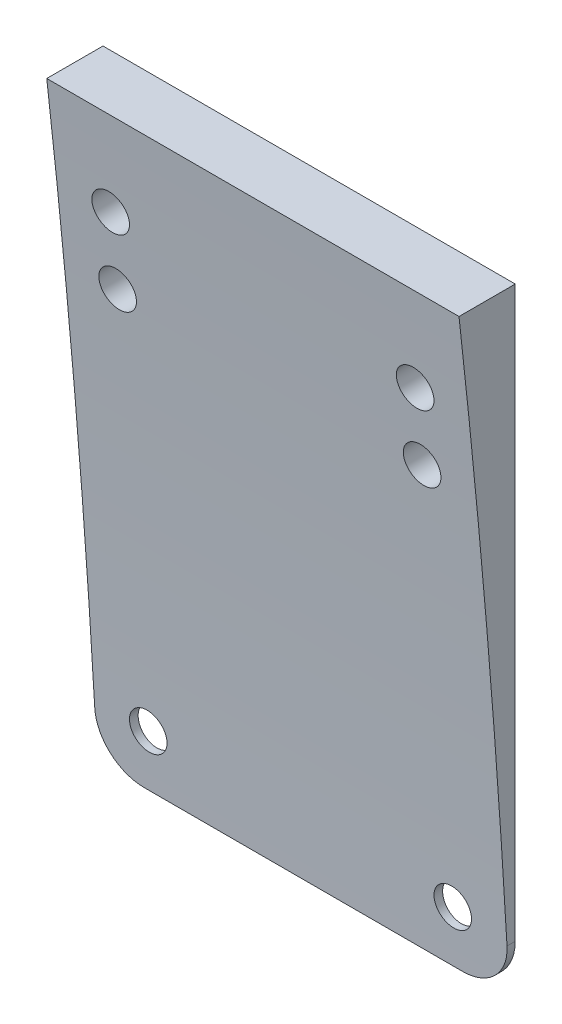
from build123d import *

# Parameters (mm, degrees)
BOSS_EXTRUDE1_DEPTH = 7.62
SKETCH2_R           = 2.54
CUT_EXTRUDE1_DEPTH  = 58.101472453
CUT_EXTRUDE2_DEPTH  = 75.849909527


with BuildPart() as part:
    # Sketch1 → Boss-Extrude1 (new body)
    with BuildSketch(Plane.XY):
        with BuildLine():
            Line((27.94, 49.2125), (-27.94, 49.2125))
            Line((-27.94, 49.2125), (-27.94, -27.94))
            ThreePointArc((-27.94, -27.94), (-26.080128061, -32.430128061), (-21.59, -34.29))
            Line((-21.59, -34.29), (21.59, -34.29))
            ThreePointArc((21.59, -34.29), (26.080128061, -32.430128061), (27.94, -27.94))
            Line((27.94, -27.94), (27.94, 49.2125))
        make_face()
    extrude(amount=BOSS_EXTRUDE1_DEPTH)

    # Sketch2 → Cut-Extrude1 (cut, through all)
    with BuildSketch(Plane.XY.offset(7.62)):
        with Locations((-20.6375, 36.5125)):
            Circle(SKETCH2_R)
        with Locations((-20.6375, 26.9875)):
            Circle(SKETCH2_R)
        with Locations((-20.6375, -26.9875)):
            Circle(SKETCH2_R)
        with Locations((20.6375, 36.5125)):
            Circle(SKETCH2_R)
        with Locations((20.6375, 26.9875)):
            Circle(SKETCH2_R)
        with Locations((20.6375, -26.9875)):
            Circle(SKETCH2_R)
    extrude(amount=-CUT_EXTRUDE1_DEPTH, mode=Mode.SUBTRACT)

    # Sketch3 → Cut-Extrude2 (cut, through all)
    with BuildSketch(Plane(origin=(27.94, 0, 0), x_dir=(0, 0, -1), z_dir=(1, 0, 0))):
        with BuildLine():
            ThreePointArc((-1.112162836, -27.94), (-3.848021385, 10.679948524), (-7.62, 49.2125))
            Line((-7.62, 49.2125), (-7.62, -27.94))
            Line((-7.62, -27.94), (-1.112162836, -27.94))
        make_face()
        with BuildLine():
            Line((-1.112162836, -27.94), (-7.62, -27.94))
            Line((-7.62, -27.94), (-7.62, -34.29))
            Line((-7.62, -34.29), (-0.762, -34.29))
            ThreePointArc((-0.762, -34.29), (-0.933579794, -31.114806907), (-1.112162836, -27.94))
        make_face()
    extrude(amount=-CUT_EXTRUDE2_DEPTH, mode=Mode.SUBTRACT)


solid = part.part
